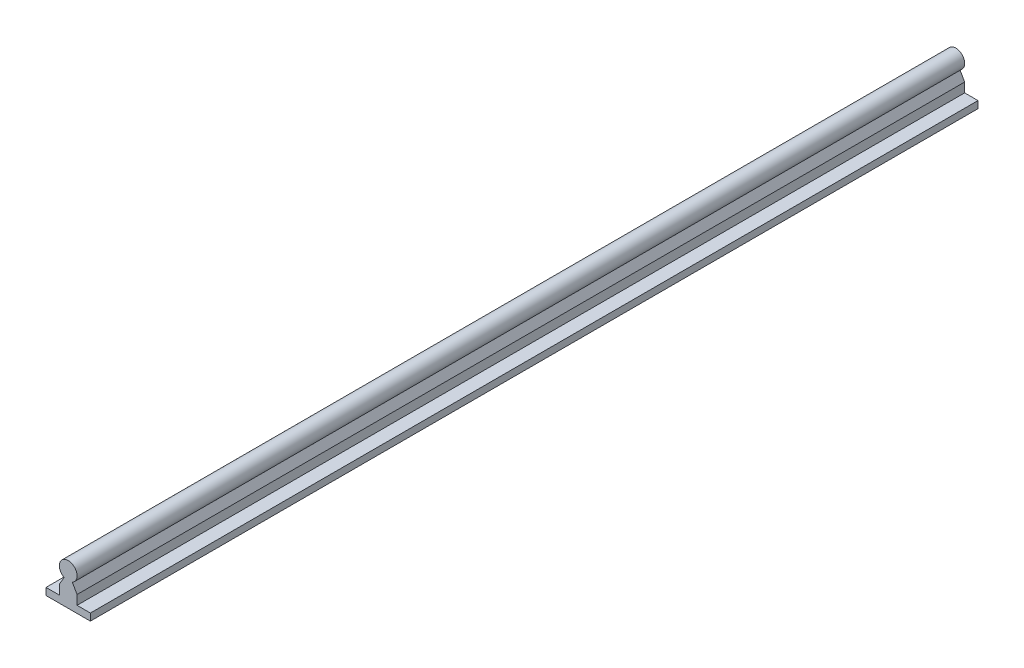
from build123d import *

# Parameters (mm, degrees)
BOSS_EXTRUDE1_DEPTH = 600


with BuildPart() as part:
    # Sketch1 → Boss-Extrude1 (new body)
    with BuildSketch(Plane.XY):
        with BuildLine():
            Line((15, 0), (-15, 0))
            Line((-15, 0), (-15, 4.7625))
            Line((-15, 4.7625), (-6, 4.7625))
            Line((-6, 4.7625), (-6, 11.1125))
            Line((-6, 11.1125), (-2.783018763, 16.684474949))
            ThreePointArc((-2.783018763, 16.684474949), (0, 28), (2.783018763, 16.684474949))
            Line((2.783018763, 16.684474949), (6, 11.1125))
            Line((6, 11.1125), (6, 4.7625))
            Line((6, 4.7625), (15, 4.7625))
            Line((15, 4.7625), (15, 0))
        make_face()
    extrude(amount=BOSS_EXTRUDE1_DEPTH)


solid = part.part
